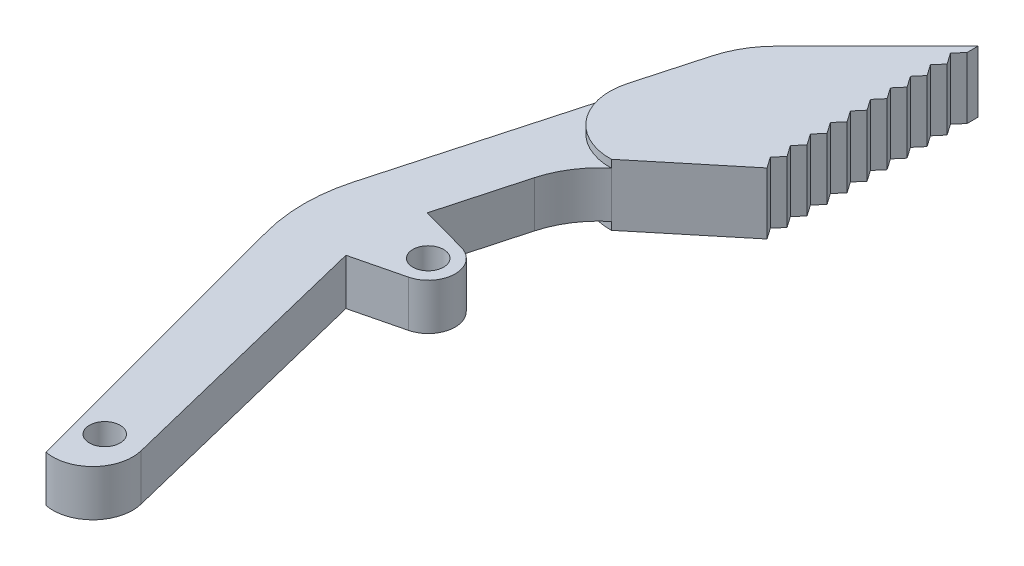
from build123d import *

# Parameters (mm, degrees)
BOSS_EXTRUDE1_DEPTH = 50
SKETCH2_R           = 10
CUT_EXTRUDE1_DEPTH  = 145
SKETCH3_R           = 10
CUT_EXTRUDE2_DEPTH  = 145
SCALE1_SCALE        = 0.2
BOSS_EXTRUDE2_START = -10
SKETCH4_R           = 2
BOSS_EXTRUDE2_DEPTH = 10
CUT_EXTRUDE3_DEPTH  = 4
SKETCH6_R           = 2
BOSS_EXTRUDE3_DEPTH = 6
BOSS_EXTRUDE4_DEPTH = 1
CUT_EXTRUDE4_DEPTH  = 10
LPATTERN1_COUNT     = 5
LPATTERN1_PITCH     = 5.2


with BuildPart() as part:
    # Sketch1 → Boss-Extrude1 (new body)
    with BuildSketch(Plane(origin=(0, 0, 0), x_dir=(1, 0, 0), z_dir=(0, 1, 0))):
        with BuildLine():
            Line((156.72428326, 188.749431717), (104.362522104, 384.675710784))
            ThreePointArc((104.362522104, 384.675710784), (100.737911875, 412.774532685), (104.619514578, 440.839007595))
            Line((104.619514578, 440.839007595), (155.108674524, 623.056486958))
            ThreePointArc((155.108674524, 623.056486958), (161.096577838, 637.255812747), (170.503706822, 649.461621332))
            Line((170.503706822, 649.461621332), (236.039412862, 714.997327373))
            Line((236.039412862, 714.997327373), (236.039412862, 577.933775776))
            Line((236.039412862, 577.933775776), (180.600392658, 532.253421954))
            ThreePointArc((180.600392658, 532.253421954), (168.395698805, 518.565657016), (160.895546094, 501.83074828))
            Line((160.895546094, 501.83074828), (142.173951469, 433.630653577))
            ThreePointArc((142.173951469, 433.630653577), (140.038780006, 418.542072662), (141.773673112, 403.40224515))
            Line((141.773673112, 403.40224515), (186.844856765, 220.358050312))
            ThreePointArc((186.844856765, 220.358050312), (180.4464863, 196.299603446), (156.72428326, 188.749431717))
        make_face()
    extrude(amount=BOSS_EXTRUDE1_DEPTH)

    # Sketch2 → Cut-Extrude1 (cut)
    with BuildSketch(Plane(origin=(0, 50, 0), x_dir=(1, 0, 0), z_dir=(0, 1, 0))):
        with Locations(Location((120.492692433, 416.694560019, 0), (0, 0, 270))):
            Circle(SKETCH2_R)
    extrude(amount=-CUT_EXTRUDE1_DEPTH, mode=Mode.SUBTRACT)

    # Sketch3 → Cut-Extrude2 (cut)
    with BuildSketch(Plane(origin=(0, 50, 0), x_dir=(1, 0, 0), z_dir=(0, 1, 0))):
        with Locations(Location((165.652720942, 217.997652258, 0), (0, 0, 270))):
            Circle(SKETCH3_R)
    extrude(amount=-CUT_EXTRUDE2_DEPTH, mode=Mode.SUBTRACT)


with BuildPart() as part_1:
    # Scale1: scaled about (165.170943501, 25, -479.501481674)
    add(part.part.scale(SCALE1_SCALE).moved(Location((132.136754801, 20, -383.601185339))))

    # Sketch4 → Boss-Extrude2 (add)
    with BuildSketch(Plane(origin=(0, 30, 0), x_dir=(1, 0, 0), z_dir=(0, 1, 0)).offset(BOSS_EXTRUDE2_START)):
        with BuildLine():
            Line((167.333433502, 464.60578312), (160.807348984, 462.998857787))
            Line((160.807348984, 462.998857787), (160.491489423, 464.281634369))
            ThreePointArc((160.491489423, 464.281634369), (160.144510802, 467.309599871), (160.571545095, 470.327316054))
            Line((160.571545095, 470.327316054), (161.32024353, 473.054717497))
            Line((161.32024353, 473.054717497), (167.42312855, 471.379415727))
            ThreePointArc((167.42312855, 471.379415727), (169.9963123, 467.957931993), (167.333433502, 464.60578312))
        make_face()
        with Locations(Location((166.496619113, 468.004274209, 0), (0, 0, 270))):
            Circle(SKETCH4_R, mode=Mode.SUBTRACT)
    extrude(amount=BOSS_EXTRUDE2_DEPTH)

    # Sketch5 → Cut-Extrude3 (cut)
    with BuildSketch(Plane.XZ.offset(-20)):
        with BuildLine():
            Line((167.333433502, -464.60578312), (160.807348984, -462.998857787))
            Line((160.807348984, -462.998857787), (169.505726154, -427.672795401))
            ThreePointArc((169.505726154, -427.672795401), (168.226052061, -422.861106028), (163.481611453, -421.351071682))
            Line((163.481611453, -421.351071682), (153.009259222, -460.536327496))
            ThreePointArc((153.009259222, -460.536327496), (152.284337176, -466.156091876), (153.060657717, -471.768986858))
            Line((153.060657717, -471.768986858), (163.158489706, -508.21248273))
            ThreePointArc((163.158489706, -508.21248273), (164.356070369, -511.052347888), (166.237496165, -513.493509605))
            Line((166.237496165, -513.493509605), (179.344637373, -526.600650813))
            Line((179.344637373, -526.600650813), (179.344637373, -499.187940494))
            Line((179.344637373, -499.187940494), (168.256833333, -490.05186973))
            ThreePointArc((168.256833333, -490.05186973), (165.815894562, -487.314316742), (164.31586402, -483.967334995))
            Line((164.31586402, -483.967334995), (161.32024353, -473.054717497))
            Line((161.32024353, -473.054717497), (167.42312855, -471.379415727))
            ThreePointArc((167.42312855, -471.379415727), (169.9963123, -467.957931993), (167.333433502, -464.60578312))
        make_face()
    extrude(amount=-CUT_EXTRUDE3_DEPTH, mode=Mode.SUBTRACT)

    # Sketch6 → Boss-Extrude3 (add)
    with BuildSketch(Plane(origin=(0, 30, 0), x_dir=(1, 0, 0), z_dir=(0, 1, 0))):
        with Locations((156.235293288, 466.940097343)):
            Circle(SKETCH6_R)
    extrude(amount=-BOSS_EXTRUDE3_DEPTH)

    # Sketch7 → Boss-Extrude4 (add)
    with BuildSketch(Plane(origin=(0, 30, 0), x_dir=(1, 0, 0), z_dir=(0, 1, 0))):
        with BuildLine():
            Line((179.344637373, 526.600650813), (166.237496165, 513.493509605))
            ThreePointArc((166.237496165, 513.493509605), (164.356070369, 511.052347888), (163.158489706, 508.21248273))
            Line((163.158489706, 508.21248273), (160.776954555, 499.617423264))
            ThreePointArc((160.776954555, 499.617423264), (162.10559666, 492.949108842), (168.256833333, 490.05186973))
            Line((168.256833333, 490.05186973), (179.344637373, 499.187940494))
            Line((179.344637373, 499.187940494), (179.344637373, 526.600650813))
        make_face()
    boss_extrude4 = extrude(amount=BOSS_EXTRUDE4_DEPTH)

    # Mirror2: Boss-Extrude4 across plane
    add(boss_extrude4.mirror(Plane.ZX.offset(27)))

    # Sketch8 → Cut-Extrude4 (cut)
    with BuildSketch(Plane(origin=(0, 31, 0), x_dir=(1, 0, 0), z_dir=(0, 1, 0))):
        Polygon((178.344637373, 500.614741506), (179.344637373, 499.187940494), (179.344637373, 501.787940494), align=None)
        Polygon((178.344637373, 503.214741506), (179.344637373, 501.787940494), (179.344637373, 504.387940494), align=None)
    cut_extrude4 = extrude(amount=-CUT_EXTRUDE4_DEPTH, mode=Mode.SUBTRACT)

    # LPattern1: Cut-Extrude4 ×5
    with Locations(*[(0, 0, -i * LPATTERN1_PITCH) for i in range(1, LPATTERN1_COUNT)]):
        add(cut_extrude4, mode=Mode.SUBTRACT)


solid = part_1.part
